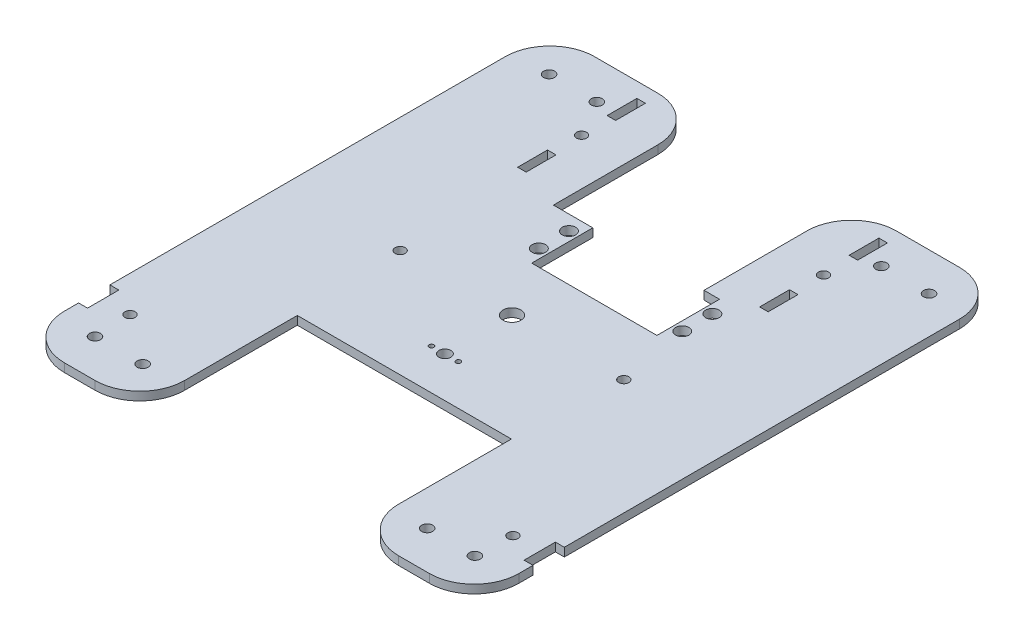
from build123d import *

# Parameters (mm, degrees)
SKETCH4_W               = 152.4
SKETCH4_H               = 177.8
BOSS_EXTRUDE2_DEPTH     = 2.85
SKETCH5_R               = 1.5
CUT_EXTRUDE1_DEPTH      = 118.122894858
SKETCH6_R               = 3
CUT_EXTRUDE2_DEPTH      = 118.122894858
SKETCH7_R               = 1.7
CUT_EXTRUDE3_DEPTH      = 118.122894858
SKETCH8_W               = 50
SKETCH8_H               = 50
CUT_EXTRUDE4_DEPTH      = 118.122894858
SKETCH9_R               = 1.7
SKETCH9_W               = 3
SKETCH9_H               = 10.5
CUT_EXTRUDE5_DEPTH      = 118.122894858
SKETCH10_W              = 71.8
SKETCH10_H              = 52.8
CUT_EXTRUDE6_DEPTH      = 118.122894858
SKETCH11_R              = 2.25
SKETCH11_W              = 42
SKETCH11_H              = 21
CUT_EXTRUDE7_DEPTH      = 118.122894858
SKETCH12_R              = 2
SKETCH12_R_2            = 0.8
CUT_EXTRUDE8_DEPTH      = 118.122894858
SKETCH13_R              = 1.85
CUT_EXTRUDE9_DEPTH      = 118.188619328
MIRROR3_COPY_1_SKETCH_R = 1.85
MIRROR3_COPY_1_DEPTH    = 118.188619328
FILLET1_R               = 15
FILLET2_R               = 15
SKETCH14_R              = 1.7
SKETCH14_W              = 2.85
SKETCH14_H              = 10
CUT_EXTRUDE10_DEPTH     = 118.122894858


with BuildPart() as part:
    # Sketch4 → Boss-Extrude2 (new body)
    with BuildSketch(Plane(origin=(0, 0, 0), x_dir=(1, 0, 0), z_dir=(0, 1, 0))):
        Rectangle(SKETCH4_W, SKETCH4_H)
    extrude(amount=BOSS_EXTRUDE2_DEPTH)

    # Sketch5 → Cut-Extrude1 (cut, through all)
    with BuildSketch(Plane.XZ):
        with Locations(Location((0, -63.9, 0), (0, 0, 270))):
            Circle(SKETCH5_R)
    extrude(amount=-CUT_EXTRUDE1_DEPTH, mode=Mode.SUBTRACT)

    # Sketch6 → Cut-Extrude2 (cut, through all)
    with BuildSketch(Plane(origin=(0, 2.85, 0), x_dir=(1, 0, 0), z_dir=(0, 1, 0))):
        with Locations(Location((0, 0, 0), (0, 0, 270))):
            Circle(SKETCH6_R)
    extrude(amount=-CUT_EXTRUDE2_DEPTH, mode=Mode.SUBTRACT)

    # Sketch7 → Cut-Extrude3 (cut, through all)
    with BuildSketch(Plane.XZ):
        with Locations(Location((37.5, 0, 0), (0, 0, 270))):
            Circle(SKETCH7_R)
        with Locations(Location((-37.5, 0, 0), (0, 0, 270))):
            Circle(SKETCH7_R)
    extrude(amount=-CUT_EXTRUDE3_DEPTH, mode=Mode.SUBTRACT)

    # Sketch8 → Cut-Extrude4 (cut, through all)
    with BuildSketch(Plane.XZ):
        with Locations((0, -63.9)):
            Rectangle(SKETCH8_W, SKETCH8_H)
    extrude(amount=-CUT_EXTRUDE4_DEPTH, mode=Mode.SUBTRACT)

    # Sketch9 → Cut-Extrude5 (cut, through all)
    with BuildSketch(Plane(origin=(0, 2.85, 0), x_dir=(1, 0, 0), z_dir=(0, 1, 0))):
        with Locations(Location((-64.2, -63.9, 0), (0, 0, 270))):
            Circle(SKETCH9_R)
        with Locations((-74.7, -63.9)):
            Rectangle(SKETCH9_W, SKETCH9_H)
    cut_extrude5 = extrude(amount=-CUT_EXTRUDE5_DEPTH, mode=Mode.SUBTRACT)

    # Sketch10 → Cut-Extrude6 (cut, through all)
    with BuildSketch(Plane.XZ):
        with Locations((0, 62.5)):
            Rectangle(SKETCH10_W, SKETCH10_H)
    extrude(amount=-CUT_EXTRUDE6_DEPTH, mode=Mode.SUBTRACT)

    # Sketch11 → Cut-Extrude7 (cut, through all)
    with BuildSketch(Plane.XZ):
        with Locations(Location((-14.85, -23.85, 0), (0, 0, 270))):
            Circle(SKETCH11_R)
        with Locations(Location((-14.85, -33.95, 0), (0, 0, 270))):
            Circle(SKETCH11_R)
        with Locations(Location((33.25, -33.95, 0), (0, 0, 270))):
            Circle(SKETCH11_R)
        with Locations(Location((33.25, -23.85, 0), (0, 0, 270))):
            Circle(SKETCH11_R)
        with Locations((9.2, -28.9)):
            Rectangle(SKETCH11_W, SKETCH11_H)
    extrude(amount=-CUT_EXTRUDE7_DEPTH, mode=Mode.SUBTRACT)

    # Sketch12 → Cut-Extrude8 (cut, through all)
    with BuildSketch(Plane.XZ):
        with Locations(Location((0, 22.5, 0), (0, 0, 270))):
            Circle(SKETCH12_R)
        with Locations(Location((-4.5, 22.5, 0), (0, 0, 270))):
            Circle(SKETCH12_R_2)
        with Locations(Location((4.5, 22.5, 0), (0, 0, 270))):
            Circle(SKETCH12_R_2)
    extrude(amount=-CUT_EXTRUDE8_DEPTH, mode=Mode.SUBTRACT)

    # Sketch13 → Cut-Extrude9 (cut, through all)
    with BuildSketch(Plane(origin=(0, 4.85, 0), x_dir=(1, 0, 0), z_dir=(0, 1, 0))):
        with Locations(Location((-63.7, -76.15, 0), (0, 0, 270))):
            Circle(SKETCH13_R)
        with Locations(Location((-47.7, -76.15, 0), (0, 0, 270))):
            Circle(SKETCH13_R)
    cut_extrude9 = extrude(amount=-CUT_EXTRUDE9_DEPTH, mode=Mode.SUBTRACT)

    # Mirror1: Cut-Extrude5 across plane
    add(cut_extrude5.mirror(Plane(origin=(0, 0, 0), x_dir=(0, 0, 1), z_dir=(1, 0, 0))), mode=Mode.SUBTRACT)

    # Mirror2: Cut-Extrude9 across plane
    add(cut_extrude9.mirror(Plane.XY), mode=Mode.SUBTRACT)

    # Mirror3: Cut-Extrude9 across plane
    add(cut_extrude9.mirror(Plane(origin=(0, 0, 0), x_dir=(0, 0, 1), z_dir=(1, 0, 0))), mode=Mode.SUBTRACT)

    # Mirror3 copy 1 sketch → Mirror3 copy 1 (cut, through all)
    with BuildSketch(Plane(origin=(0, 4.85, 0), x_dir=(-1, 0, 0), z_dir=(0, 1, 0))):
        with Locations(Location((-63.7, -76.15, 0), (0, 0, 270))):
            Circle(MIRROR3_COPY_1_SKETCH_R)
        with Locations(Location((-47.7, -76.15, 0), (0, 0, 270))):
            Circle(MIRROR3_COPY_1_SKETCH_R)
    extrude(amount=-MIRROR3_COPY_1_DEPTH, mode=Mode.SUBTRACT)

    # Fillet1
    fillet1_edges = [part.edges().sort_by_distance(p)[0] for p in [
        (76.2, 1.425, 88.9),
        (-76.2, 1.425, 88.9),
        (-76.2, 1.425, -88.9),
        (76.2, 1.425, -88.9),
    ]]
    fillet(fillet1_edges, radius=FILLET1_R)

    # Fillet2
    fillet2_edges = [part.edges().sort_by_distance(p)[0] for p in [
        (25, 1.425, -88.9),
        (-25, 1.425, -88.9),
        (-35.9, 1.425, 88.9),
        (35.9, 1.425, 88.9),
    ]]
    fillet(fillet2_edges, radius=FILLET2_R)

    # Sketch14 → Cut-Extrude10 (cut, through all)
    with BuildSketch(Plane.XZ):
        with Locations(Location((40.575, -63.9, 0), (0, 0, 270))):
            Circle(SKETCH14_R)
        with Locations((40.575, -78.9)):
            Rectangle(SKETCH14_W, SKETCH14_H)
        with Locations((40.575, -48.9)):
            Rectangle(SKETCH14_W, SKETCH14_H)
    cut_extrude10 = extrude(amount=-CUT_EXTRUDE10_DEPTH, mode=Mode.SUBTRACT)

    # Mirror4: Cut-Extrude10 across plane
    add(cut_extrude10.mirror(Plane(origin=(0, 0, 0), x_dir=(0, 0, 1), z_dir=(1, 0, 0))), mode=Mode.SUBTRACT)


solid = part.part
